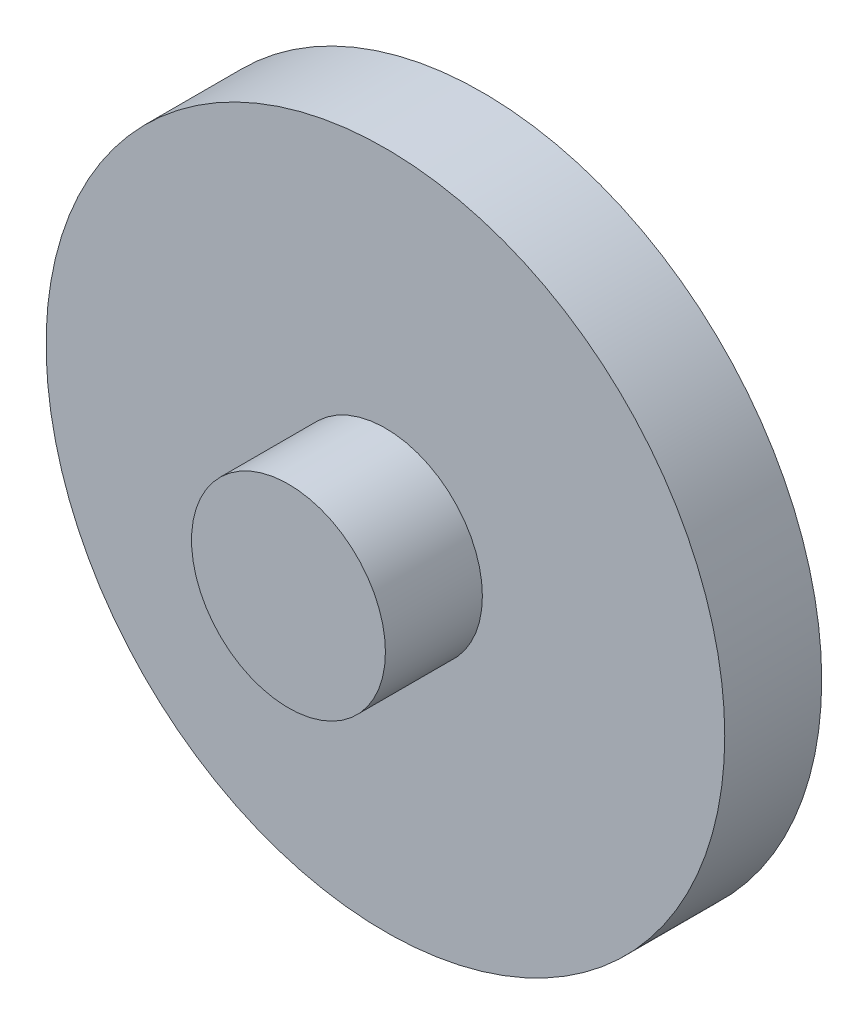
from build123d import *

# Parameters (mm, degrees)
SKETCH1_R           = 17.5
SKETCH1_R_2         = 5
BOSS_EXTRUDE1_DEPTH = 5
SKETCH1_2_R         = 5
BOSS_EXTRUDE2_DEPTH = 10


with BuildPart() as part:
    # Sketch1 → Boss-Extrude1 (new body)
    with BuildSketch(Plane.XY):
        Circle(SKETCH1_R)
        Circle(SKETCH1_R_2, mode=Mode.SUBTRACT)
    extrude(amount=BOSS_EXTRUDE1_DEPTH)

    # Sketch1<2> → Boss-Extrude2 (add)
    with BuildSketch(Plane.XY):
        Circle(SKETCH1_2_R)
    extrude(amount=BOSS_EXTRUDE2_DEPTH)


solid = part.part
